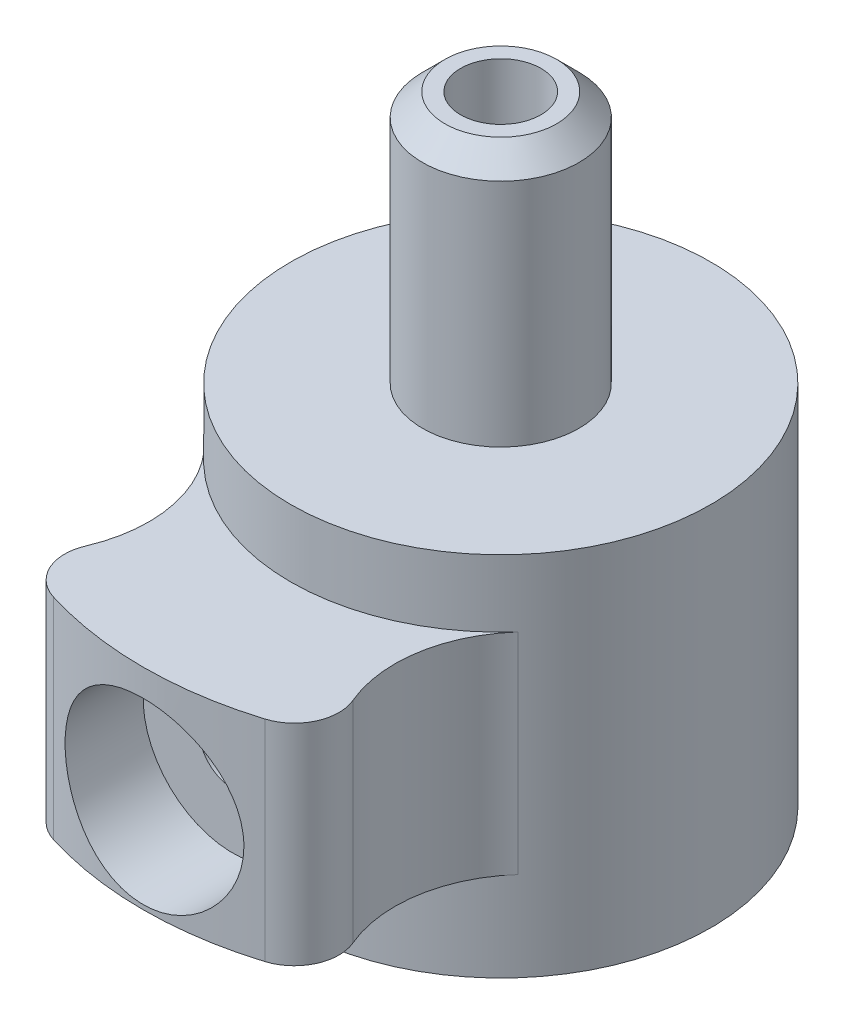
from build123d import *

# Parameters (mm, degrees)
CUT_EXTRUDE_1_DEPTH      = 14.97283078
FILLET_1_R               = 1
CUT_EXTRUDE_2_REACH      = 17.831
CUT_EXTRUDE_2_END_RADIUS = 3.4
SKETCH_3_R               = 0.75
SKETCH_4_R               = 2
CUT_EXTRUDE_3_DEPTH      = 2
SKETCH_5_OUTSIDE_W       = 15.602
SKETCH_5_OUTSIDE_H       = 18.902
SKETCH_5_OUTSIDE_R       = 4.7
CUT_EXTRUDE_4_DEPTH      = 1.5
CUT_EXTRUDE_START        = -8.2
SKETCH_5_2_OUTSIDE_W     = 15.602
SKETCH_5_2_OUTSIDE_H     = 18.902
SKETCH_5_2_OUTSIDE_R     = 4.7
CUT_EXTRUDE_5_DEPTH      = 2
CHAMFER_1_SIZE           = 0.5


with BuildPart() as part:
    # Эскиз1 → Повернуть1 (revolve)
    with BuildSketch(Plane(origin=(0, 0, 0), x_dir=(0, 0, -1), z_dir=(1, 0, 0)), mode=Mode.PRIVATE) as revolve_1_sk:
        Polygon((-3.4, 0), (-3.4, 6.5), (-0.9, 6.5), (-0.9, 13.85), (-1.75, 13.85), (-1.75, 8.2), (-8, 8.2), (-8, 0), align=None)
    revolve(revolve_1_sk.sketch.rotate(Axis((0, 0, 0), (0, 1, 0)), 180), axis=Axis((0, 0, 0), (0, 1, 0)))

    # Эскиз2 → Вырез-Вытянуть1 (cut, through all)
    with BuildSketch(Plane(origin=(0, 8.2, 0), x_dir=(1, 0, 0), z_dir=(0, 1, 0))):
        with BuildLine():
            ThreePointArc((7.99025974, -7.116582697), (0, 10.7), (-7.99025974, -7.116582697))
            ThreePointArc((-7.99025974, -7.116582697), (-3.75469644, -7.361538877), (-3.50974026, -3.125975577))
            ThreePointArc((-3.50974026, -3.125975577), (0, 4.7), (3.50974026, -3.125975577))
            ThreePointArc((3.50974026, -3.125975577), (3.75469644, -7.361538877), (7.99025974, -7.116582697))
        make_face()
    extrude(amount=-CUT_EXTRUDE_1_DEPTH, mode=Mode.SUBTRACT)

    # Скругление1
    fillet_1_edges = [part.edges().sort_by_distance(p)[0] for p in [
        (-3.555293146, 4.1, 7.166581517),
        (3.555293146, 4.1, 7.166581517),
    ]]
    fillet(fillet_1_edges, radius=FILLET_1_R)

    # Вырез-Вытянуть2: up to this cylinder (the profile starts outside it)
    cut_extrude_2_end = Plane(origin=(0, 4.1, 0), z_dir=(0, -1, 0)) * Cylinder(CUT_EXTRUDE_2_END_RADIUS, 43.462, mode=Mode.PRIVATE)
    # Эскиз3 → Вырез-Вытянуть2 (cut, up to the surface)
    with BuildSketch(Plane(origin=(0, 8.2, 8), x_dir=(1, 0, 0), z_dir=(0, 0, 1)), mode=Mode.PRIVATE) as cut_extrude_2_sk1:
        with Locations((0, -4.1)):
            Circle(SKETCH_3_R)
    cut_extrude_2_tool1 = extrude(cut_extrude_2_sk1.sketch, amount=-CUT_EXTRUDE_2_REACH, mode=Mode.PRIVATE) - cut_extrude_2_end
    add(cut_extrude_2_tool1.solids().sort_by_distance((0, 4.1, 8))[0], mode=Mode.SUBTRACT)

    # Эскиз4 → Вырез-Вытянуть3 (cut)
    with BuildSketch(Plane(origin=(0, 8.2, 8), x_dir=(1, 0, 0), z_dir=(0, 0, 1))):
        with Locations((0, -4.1)):
            Circle(SKETCH_4_R)
    extrude(amount=-CUT_EXTRUDE_3_DEPTH, mode=Mode.SUBTRACT)

    # Эскиз5 outside → Вырез-Вытянуть4 (cut)
    with BuildSketch(Plane(origin=(0, 8.2, 0), x_dir=(1, 0, 0), z_dir=(0, 1, 0))):
        with Locations((0, -1.65)):
            Rectangle(SKETCH_5_OUTSIDE_W, SKETCH_5_OUTSIDE_H)
        with Locations(Location((0, 0, 0), (0, 0, 270))):
            Circle(SKETCH_5_OUTSIDE_R, mode=Mode.SUBTRACT)
    extrude(amount=-CUT_EXTRUDE_4_DEPTH, mode=Mode.SUBTRACT)

    # Эскиз5<2> outside → Вырез-Вытянуть5 (cut)
    with BuildSketch(Plane(origin=(0, 8.2, 0), x_dir=(1, 0, 0), z_dir=(0, 1, 0)).offset(CUT_EXTRUDE_START)):
        with Locations((0, -1.65)):
            Rectangle(SKETCH_5_2_OUTSIDE_W, SKETCH_5_2_OUTSIDE_H)
        with Locations(Location((0, 0, 0), (0, 0, 270))):
            Circle(SKETCH_5_2_OUTSIDE_R, mode=Mode.SUBTRACT)
    extrude(amount=CUT_EXTRUDE_5_DEPTH, mode=Mode.SUBTRACT)

    # Фаска1
    chamfer_1_edges = [part.edges().sort_by_distance(p)[0] for p in [
        (0, 13.85, 1.75),
    ]]
    chamfer(chamfer_1_edges, length=CHAMFER_1_SIZE)


solid = part.part
